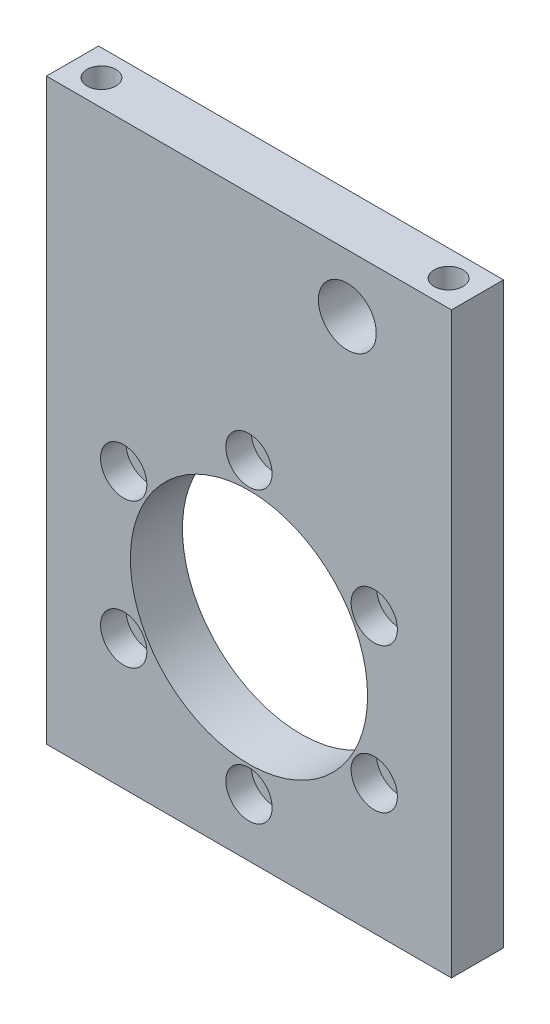
from build123d import *

# Parameters (mm, degrees)
SKETCH1_W                                           = 70
SKETCH1_H                                           = 100
BOSS_EXTRUDE1_DEPTH                                 = 4.5
CUT_EXTRUDE2_DEPTH                                  = 123.148475226
CUT_EXTRUDE2_DEPTH_BACK                             = 123.148475226
SKETCH3_R                                           = 20.5
M6_TAPPED_HOLE1_AT_2_COUNT                          = 2
M6_TAPPED_HOLE1_AT_2_PITCH                          = 60
CBORE_FOR_M4_HEX_SOCKET_HEAD_CAP_SCREW1_D           = 4.3
CBORE_FOR_M4_HEX_SOCKET_HEAD_CAP_SCREW1_CBORE_D     = 8
CBORE_FOR_M4_HEX_SOCKET_HEAD_CAP_SCREW1_CBORE_DEPTH = 4.4
CIRPATTERN1_COUNT                                   = 6
SKETCH8_R                                           = 5
CUT_EXTRUDE3_DEPTH                                  = 10


with BuildPart() as part:
    # Sketch1 → Boss-Extrude1 (new, symmetric)
    with BuildSketch(Plane.XY):
        with Locations((35, 50)):
            Rectangle(SKETCH1_W, SKETCH1_H)
    extrude(amount=BOSS_EXTRUDE1_DEPTH, both=True)

    # Sketch3 → Cut-Extrude2 (cut, two sides: drawn at the far end of the back side and taken through both)
    with BuildSketch(Plane.XY.offset(-CUT_EXTRUDE2_DEPTH_BACK)):
        with Locations((35, 35)):
            Circle(SKETCH3_R)
    extrude(amount=CUT_EXTRUDE2_DEPTH + CUT_EXTRUDE2_DEPTH_BACK, mode=Mode.SUBTRACT)

    # Sketch5 → M6 Tapped Hole1 (revolve, cut)
    with BuildSketch(Plane(origin=(65, 0, 0), x_dir=(0, 0, -1), z_dir=(1, 0, 0))):
        Polygon((0, 0), (0, 16.502151548), (2.5, 15), (2.5, 0), align=None)
    m6_tapped_hole1 = revolve(axis=Axis((65, -6.35, 0), (0, 1, 0)), mode=Mode.SUBTRACT)

    # M6 Tapped Hole1 at 2: M6 Tapped Hole1 ×2
    with Locations(*[(-i * M6_TAPPED_HOLE1_AT_2_PITCH, 0, 0) for i in range(1, M6_TAPPED_HOLE1_AT_2_COUNT)]):
        add(m6_tapped_hole1, mode=Mode.SUBTRACT)

    # Mirror1: M6 Tapped Hole1 across plane
    add(m6_tapped_hole1.mirror(Plane.ZX.offset(50)), mode=Mode.SUBTRACT)

    # Mirror1 copy 1 sketch → Mirror1 copy 1 (revolve, cut)
    with BuildSketch(Plane(origin=(5, 100, 0), x_dir=(0, 0, -1), z_dir=(1, 0, 0))):
        Polygon((0, 0), (0, -16.502151548), (2.5, -15), (2.5, 0), align=None)
    revolve(axis=Axis((5, 106.35, 0), (0, 1, 0)), mode=Mode.SUBTRACT)

    # CBORE for M4 Hex Socket Head Cap Screw1 (through all)
    with Locations(Plane.XY.offset(4.5)):
        with Locations((35, 60)):
            cbore_for_m4_hex_socket_head_cap_screw1 = CounterBoreHole(CBORE_FOR_M4_HEX_SOCKET_HEAD_CAP_SCREW1_D / 2, CBORE_FOR_M4_HEX_SOCKET_HEAD_CAP_SCREW1_CBORE_D / 2, CBORE_FOR_M4_HEX_SOCKET_HEAD_CAP_SCREW1_CBORE_DEPTH)

    # CirPattern1: CBORE for M4 Hex Socket Head Cap Screw1 ×6 about axis
    cirpattern1_axis = Axis((35, 35, 0), (0, 0, 1))
    for i in range(1, CIRPATTERN1_COUNT):
        add(cbore_for_m4_hex_socket_head_cap_screw1.rotate(cirpattern1_axis, i * 360 / CIRPATTERN1_COUNT), mode=Mode.SUBTRACT)

    # Sketch8 → Cut-Extrude3 (cut)
    with BuildSketch(Plane.XY.offset(4.5)):
        with Locations((52, 90)):
            Circle(SKETCH8_R)
    extrude(amount=-CUT_EXTRUDE3_DEPTH, mode=Mode.SUBTRACT)


solid = part.part
